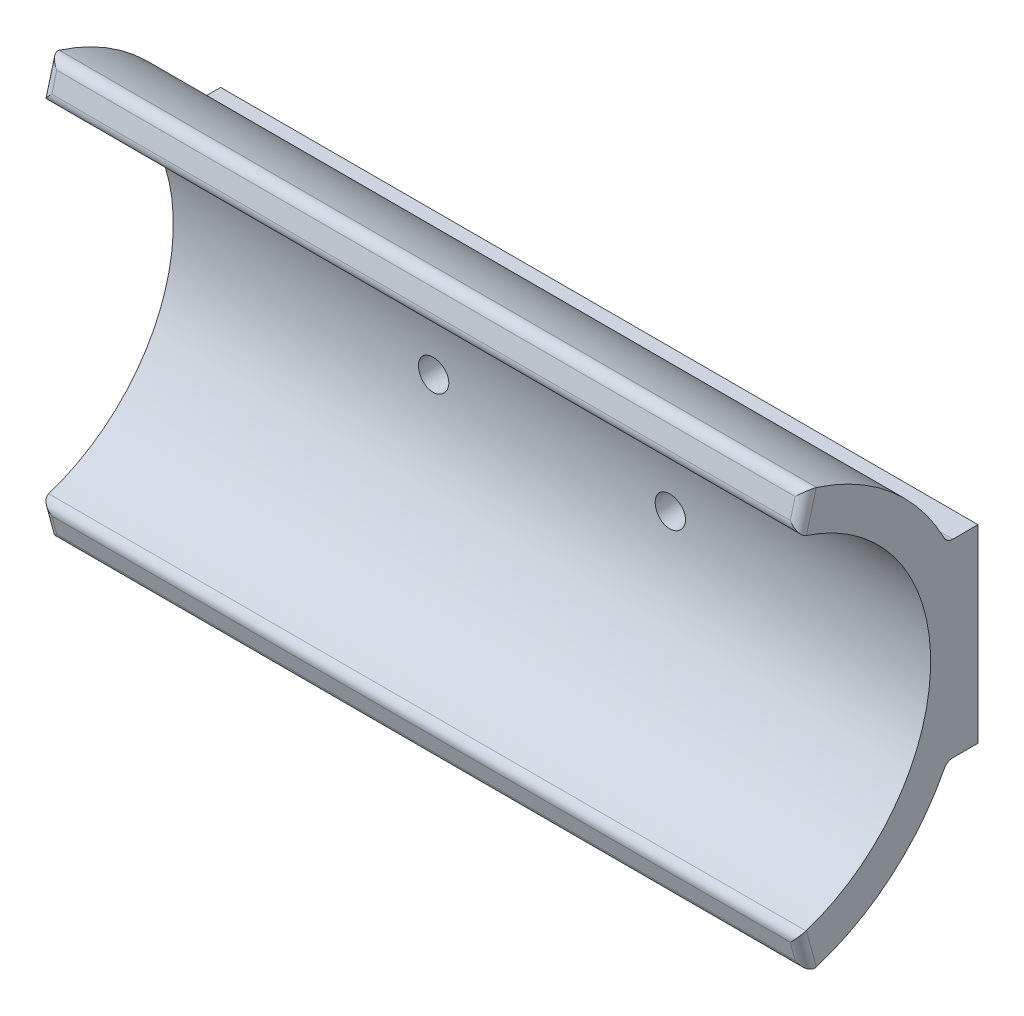
from build123d import *

# Parameters (mm, degrees)
BOSS_EXTRUDE1_DEPTH     = 40
CUT_EXTRUDE1_DEPTH      = 50.57522733
CUT_EXTRUDE1_DEPTH_BACK = 50.57522733
SKETCH2_R               = 1.6
FILLET1_R               = 1


with BuildPart() as part:
    # Sketch1 → Boss-Extrude1 (new, symmetric)
    with BuildSketch(Plane.YZ):
        with BuildLine():
            Line((18.352590699, -4.917561857), (22.216294005, -5.952838037))
            ThreePointArc((22.216294005, -5.952838037), (17.718152872, -14.665164806), (10, -20.712315177))
            Line((10, -20.712315177), (10, -24))
            Line((10, -24), (-10, -24))
            Line((-10, -24), (-10, -20.712315177))
            ThreePointArc((-10, -20.712315177), (-17.718152872, -14.665164806), (-22.216294005, -5.952838037))
            Line((-22.216294005, -5.952838037), (-18.352590699, -4.917561857))
            ThreePointArc((-18.352590699, -4.917561857), (0, -19), (18.352590699, -4.917561857))
        make_face()
    extrude(amount=BOSS_EXTRUDE1_DEPTH, both=True)

    # Sketch2 → Cut-Extrude1 (cut, two sides: drawn at the far end of the back side and taken through both)
    with BuildSketch(Plane(origin=(0, 0, -24), x_dir=(-1, 0, 0), z_dir=(0, 0, -1)).offset(-CUT_EXTRUDE1_DEPTH_BACK)):
        with Locations((12.5, 0)):
            Circle(SKETCH2_R)
        with Locations((-12.5, 0)):
            Circle(SKETCH2_R)
    extrude(amount=CUT_EXTRUDE1_DEPTH + CUT_EXTRUDE1_DEPTH_BACK, mode=Mode.SUBTRACT)

    # Fillet1
    fillet1_edges = [part.edges().sort_by_distance(p)[0] for p in [
        (-40, -20.284442352, -5.435199947),
        (0, 18.352590699, -4.917561857),
        (0, 22.216294005, -5.952838037),
        (0, 10, -20.712315177),
        (0, -10, -20.712315177),
        (0, -22.216294005, -5.952838037),
        (0, -18.352590699, -4.917561857),
        (40, 20.284442352, -5.435199947),
        (-40, 20.284442352, -5.435199947),
        (40, -20.284442352, -5.435199947),
    ]]
    fillet(fillet1_edges, radius=FILLET1_R)


solid = part.part
